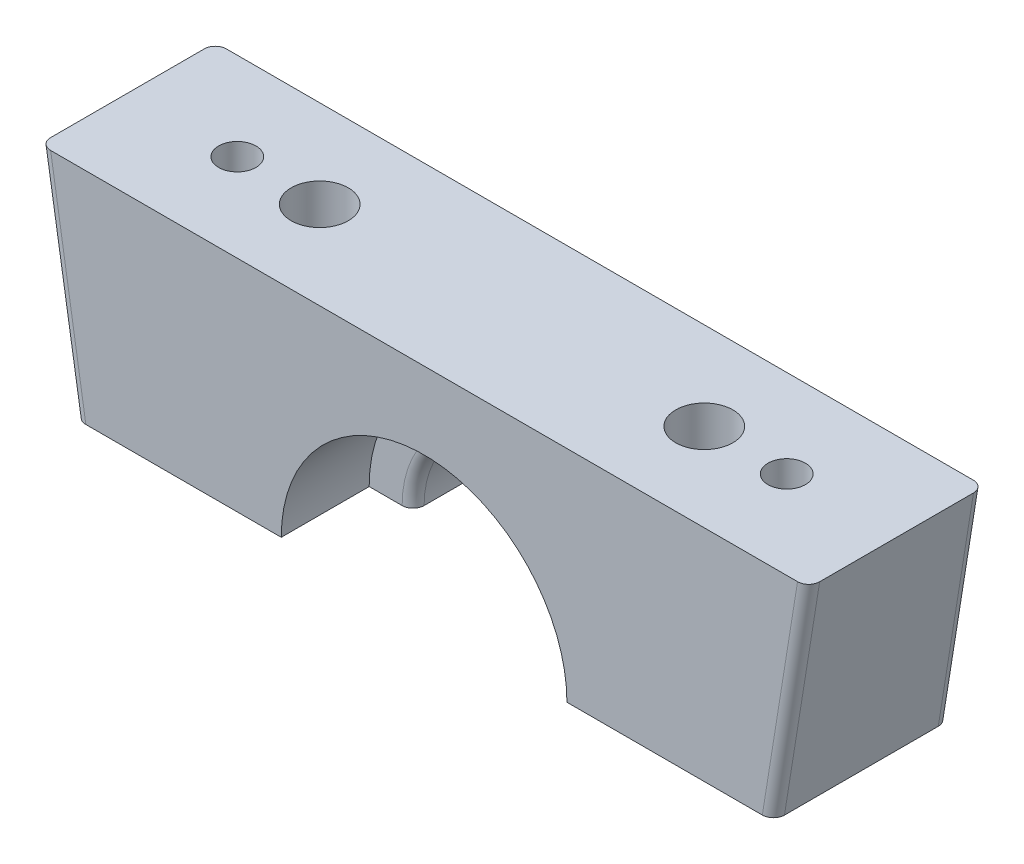
from build123d import *

# Parameters (mm, degrees)
DODANIE_WYCI_GNI_CIE1_DEPTH                          = 8
WYTNIJ_WYCI_GNI_CIE1_DEPTH                           = 8
WYTNIJ_WYCI_GNI_CIE2_DEPTH                           = 42.097445176
WYTNIJ_WYCI_GNI_CIE2_DEPTH_BACK                      = 42.097445176
POG_BIENIE_STO_KOWE_POD_M3_WKR_T_DO_CZ_C_D           = 3.4
POG_BIENIE_STO_KOWE_POD_M3_WKR_T_DO_CZ_C_CSINK_D     = 6.3
POG_BIENIE_STO_KOWE_POD_M3_WKR_T_DO_CZ_C_CSINK_ANGLE = 90
OTWORY_USTALAJ_CE_5_0MM1_D                           = 5.2
SZKIC8_R                                             = 3.25
WYTNIJ_WYCI_GNI_CIE3_DEPTH                           = 10
ZAOKR_GLENIE1_R                                      = 1


with BuildPart() as part:
    # Szkic1 → Dodanie-wyciągnięcie1 (new, symmetric)
    with BuildSketch(Plane.XY):
        Polygon((0, 0), (35, 0), (31.794871795, -20), (0, -20), align=None)
    dodanie_wyci_gni_cie1 = extrude(amount=DODANIE_WYCI_GNI_CIE1_DEPTH, both=True)

    # Lustro1: Dodanie-wyciągnięcie1 across plane
    add(dodanie_wyci_gni_cie1.mirror(Plane(origin=(0, -20, 8), x_dir=(0, 0, 1), z_dir=(1, 0, 0))))

    # Szkic2 → Wytnij-wyciągnięcie1 (cut)
    with BuildSketch(Plane.XY.offset(8)):
        with BuildLine():
            Line((-13, -20), (13, -20))
            ThreePointArc((13, -20), (0, -7), (-13, -20))
        make_face()
    extrude(amount=-WYTNIJ_WYCI_GNI_CIE1_DEPTH, mode=Mode.SUBTRACT)

    # Szkic3 → Wytnij-wyciągnięcie2 (cut, two sides: drawn at the far end of the back side and taken through both)
    with BuildSketch(Plane.XY.offset(-WYTNIJ_WYCI_GNI_CIE2_DEPTH_BACK)):
        with BuildLine():
            ThreePointArc((9, -20), (0, -11), (-9, -20))
            Line((-9, -20), (9, -20))
        make_face()
    extrude(amount=WYTNIJ_WYCI_GNI_CIE2_DEPTH + WYTNIJ_WYCI_GNI_CIE2_DEPTH_BACK, mode=Mode.SUBTRACT)

    # Pogłębienie stożkowe pod M3 wkręt do części metalowych z łbem soczewkowym1 (through all)
    with Locations(Plane(origin=(0, -20, 0), x_dir=(-1, 0, 0), z_dir=(0, -1, 0))):
        with Locations((-25, 0), (25, 0)):
            CounterSinkHole(POG_BIENIE_STO_KOWE_POD_M3_WKR_T_DO_CZ_C_D / 2, POG_BIENIE_STO_KOWE_POD_M3_WKR_T_DO_CZ_C_CSINK_D / 2, counter_sink_angle=POG_BIENIE_STO_KOWE_POD_M3_WKR_T_DO_CZ_C_CSINK_ANGLE)

    # Otwory ustalające Ø5.0mm1 (through all)
    with Locations(Plane(origin=(0, -20, 0), x_dir=(-1, 0, 0), z_dir=(0, -1, 0))):
        with Locations((-17.5, 0), (17.5, 0)):
            Hole(OTWORY_USTALAJ_CE_5_0MM1_D / 2)

    # Szkic8 → Wytnij-wyciągnięcie3 (cut)
    with BuildSketch(Plane(origin=(0, -20, 0), x_dir=(-1, 0, 0), z_dir=(0, -1, 0))):
        with Locations(Location((17.5, 0, 0), (0, 0, 180))):
            Circle(SZKIC8_R)
        with Locations(Location((-17.5, 0, 0), (0, 0, 180))):
            Circle(SZKIC8_R)
    extrude(amount=-WYTNIJ_WYCI_GNI_CIE3_DEPTH, mode=Mode.SUBTRACT)

    # Zaokrąglenie1
    zaokr_glenie1_edges = [part.edges().sort_by_distance(p)[0] for p in [
        (33.397435897, -10, 8),
        (-33.397435897, -10, 8),
        (-33.397435897, -10, -8),
        (0, -11, 0),
        (0, -11, -8),
        (33.397435897, -10, -8),
    ]]
    fillet(zaokr_glenie1_edges, radius=ZAOKR_GLENIE1_R)


solid = part.part
